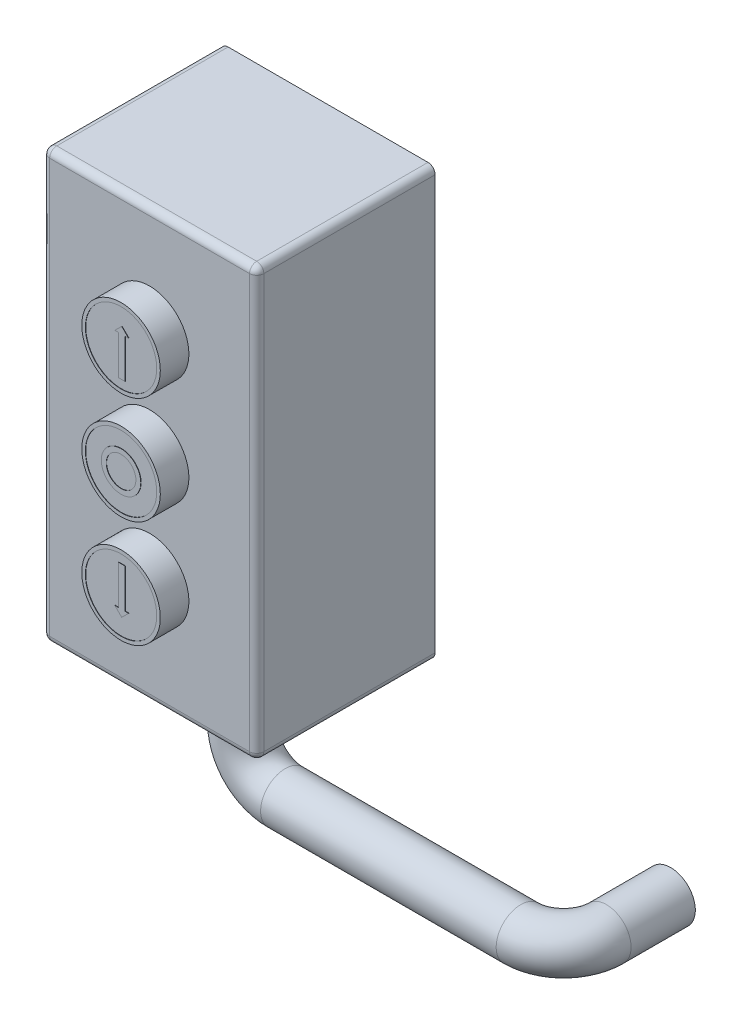
from build123d import *

# Parameters (mm, degrees)
CROQUIS1_W              = 60
CROQUIS1_H              = 120
SALIENTE_EXTRUIR1_DEPTH = 50
CROQUIS2_R              = 11
SALIENTE_EXTRUIR2_DEPTH = 8
CROQUIS3_R              = 10
CORTAR_EXTRUIR1_DEPTH   = 0.1
SALIENTE_EXTRUIR3_DEPTH = 0.1
CROQUIS5_R              = 5.530403268
CROQUIS5_R_2            = 4.15467208
SALIENTE_EXTRUIR4_DEPTH = 0.1
REDONDEO1_R             = 2
CROQUIS6_R              = 9
SALIENTE_EXTRUIR5_DEPTH = 10
CHAFL_N1_SIZE           = 3
CHAFL_N1_SIZE2          = 2.100622615
CROQUIS8_R              = 6.899377385


with BuildPart() as part:
    # Croquis1 → Saliente-Extruir1 (new body)
    with BuildSketch(Plane.XY):
        with Locations((30, 60)):
            Rectangle(CROQUIS1_W, CROQUIS1_H)
    extrude(amount=SALIENTE_EXTRUIR1_DEPTH)

    # Croquis2 → Saliente-Extruir2 (add)
    with BuildSketch(Plane.XY.offset(50)):
        with Locations(Location((30, 60, 0), (0, 0, 180))):
            Circle(CROQUIS2_R)
        with Locations(Location((30, 90, 0), (0, 0, 180))):
            Circle(CROQUIS2_R)
        with Locations(Location((30, 30, 0), (0, 0, 180))):
            Circle(CROQUIS2_R)
    extrude(amount=SALIENTE_EXTRUIR2_DEPTH)

    # Croquis3 → Cortar-Extruir1 (cut)
    with BuildSketch(Plane.XY.offset(58)):
        with Locations((30, 90)):
            Circle(CROQUIS3_R)
        with Locations((30, 60)):
            Circle(CROQUIS3_R)
        with Locations((30, 30)):
            Circle(CROQUIS3_R)
    extrude(amount=-CORTAR_EXTRUIR1_DEPTH, mode=Mode.SUBTRACT)

    # Croquis4 → Saliente-Extruir3 (add)
    with BuildSketch(Plane.XY.offset(57.9)):
        Polygon((29.277033543, 82.393028635), (31.097592421, 82.393028635), (31.097592421, 93.369086775), (32.121534281, 93.369086775), (31.097592421, 94.393028635), (30.187312982, 95.303308074), (29.277033543, 94.393028635), (28.253091683, 93.369086775), (29.277033543, 93.369086775), align=None)
        Polygon((29.277033543, 26.630913225), (28.253091683, 26.630913225), (29.277033543, 25.606971365), (30.187312982, 24.696691926), (31.097592421, 25.606971365), (32.121534281, 26.630913225), (31.097592421, 26.630913225), (31.097592421, 37.606971365), (29.277033543, 37.606971365), align=None)
    extrude(amount=SALIENTE_EXTRUIR3_DEPTH)

    # Croquis5 → Saliente-Extruir4 (add)
    with BuildSketch(Plane.XY.offset(57.9)):
        with Locations((30, 60)):
            Circle(CROQUIS5_R)
        with Locations((30, 60)):
            Circle(CROQUIS5_R_2, mode=Mode.SUBTRACT)
    extrude(amount=SALIENTE_EXTRUIR4_DEPTH)

    # Redondeo1
    redondeo1_edges = [part.edges().sort_by_distance(p)[0] for p in [
        (60, 60, 50),
        (30, 120, 50),
        (0, 60, 50),
        (30, 0, 50),
        (0, 120, 25),
        (60, 120, 25),
        (60, 0, 25),
        (0, 0, 25),
    ]]
    fillet(redondeo1_edges, radius=REDONDEO1_R)

    # Croquis6 → Saliente-Extruir5 (add)
    with BuildSketch(Plane.XZ):
        with Locations(Location((30, 24, 0), (0, 0, 90))):
            Circle(CROQUIS6_R)
    extrude(amount=SALIENTE_EXTRUIR5_DEPTH)

    # Chaflán1
    chafl_n1_edges = [part.edges().sort_by_distance(p)[0] for p in [
        (30, -10, 15),
    ]]
    chafl_n1_side = [part.faces().sort_by_distance(p)[0] for p in [
        (30, -5, 15),
    ]]
    chamfer(chafl_n1_edges, length=CHAFL_N1_SIZE, length2=CHAFL_N1_SIZE2, reference=chafl_n1_side[0])

    # Barrer1: sweep along a curve in space
    with BuildLine() as barrer1_path:
        Line((30, -10, 24), (30, -18, 24))
        ThreePointArc((30, -18, 24), (33.514718626, -26.485281374, 24), (42, -30, 24))
        Line((42, -30, 24), (108, -30, 24))
        ThreePointArc((108, -30, 24), (116.485281374, -30, 20.485281374), (120, -30, 12))
        Line((120, -30, 12), (120, -30, -6))
    # Croquis8 → Barrer1 (sweep)
    with BuildSketch(Plane.XZ.offset(10)):
        with Locations((30, 24)):
            Circle(CROQUIS8_R)
    sweep(path=barrer1_path.line)


solid = part.part
